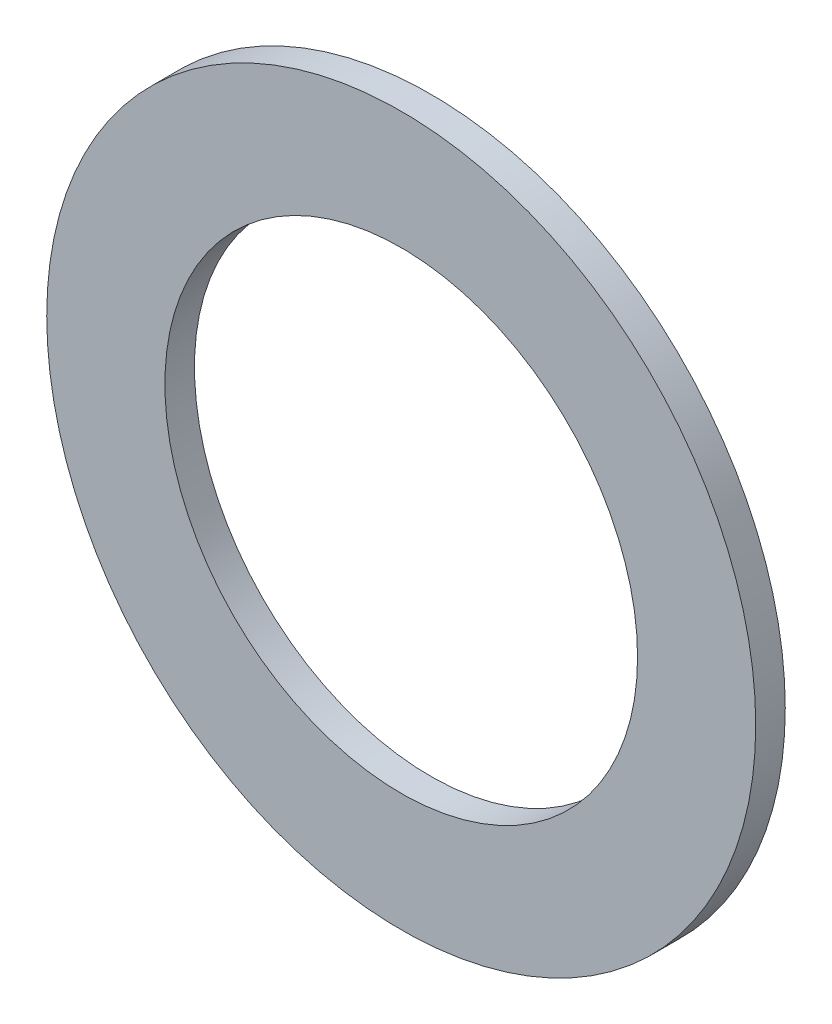
from build123d import *

# Parameters (mm, degrees)
ESQUISSE1_R        = 76.2
ESQUISSE1_R_2      = 50.8
BOSS_EXTRU_1_DEPTH = 6.35


with BuildPart() as part:
    # Esquisse1 → Boss.-Extru.1 (new body)
    with BuildSketch(Plane.XY):
        Circle(ESQUISSE1_R)
        Circle(ESQUISSE1_R_2, mode=Mode.SUBTRACT)
    extrude(amount=BOSS_EXTRU_1_DEPTH)


solid = part.part
